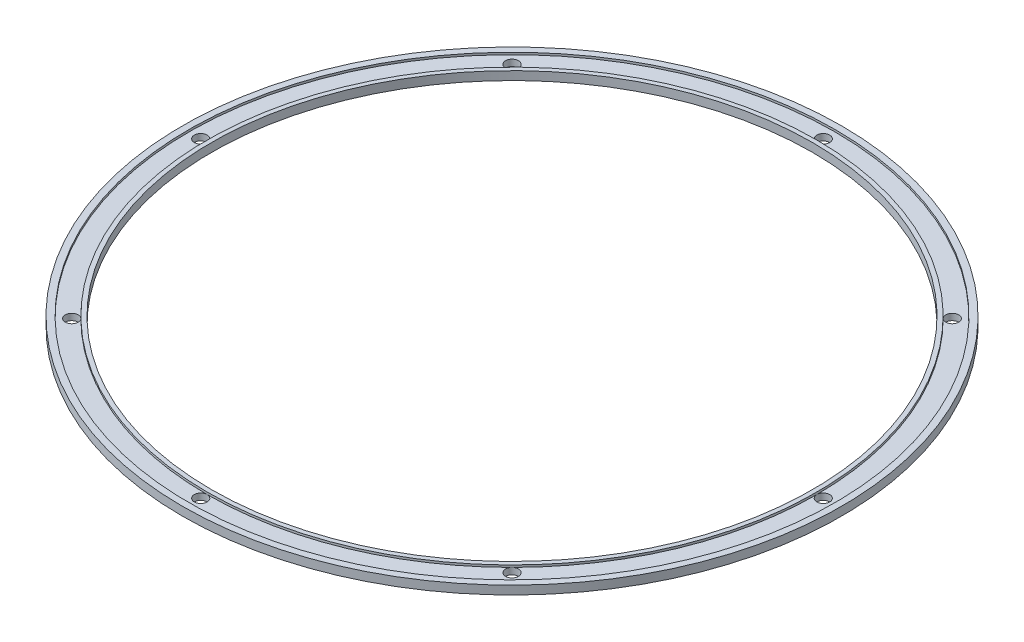
from build123d import *

# Parameters (mm, degrees)
SKETCH_2_R          = 1.5
CUT_EXTRUDE_1_DEPTH = 109.551255175


with BuildPart() as part:
    # 草图1 → 旋转1 (revolve)
    with BuildSketch(Plane.XY, mode=Mode.PRIVATE) as revolve_1_sk:
        Polygon((70, 0), (76.75, 0), (76.75, 2), (75.25, 2), (75.25, 1.5), (71, 1.5), (71, 2), (70, 2), align=None)
    revolve(revolve_1_sk.sketch.rotate(Axis((0, 112.572086065, 0), (0, -1, 0)), 90), axis=Axis((0, 112.572086065, 0), (0, -1, 0)))

    # 草图2 → 切除-拉伸1 (cut, through all)
    with BuildSketch(Plane(origin=(0, 1.5, 0), x_dir=(1, 0, 0), z_dir=(0, 1, 0))):
        with Locations(Location((0, 72.5, 0), (0, 0, 270))):
            Circle(SKETCH_2_R)
        with Locations(Location((51.265241636, 51.265241636, 0), (0, 0, 270))):
            Circle(SKETCH_2_R)
        with Locations(Location((72.5, 0, 0), (0, 0, 270))):
            Circle(SKETCH_2_R)
        with Locations(Location((51.265241636, -51.265241636, 0), (0, 0, 270))):
            Circle(SKETCH_2_R)
        with Locations(Location((0, -72.5, 0), (0, 0, 270))):
            Circle(SKETCH_2_R)
        with Locations(Location((-51.265241636, -51.265241636, 0), (0, 0, 270))):
            Circle(SKETCH_2_R)
        with Locations(Location((-72.5, 0, 0), (0, 0, 270))):
            Circle(SKETCH_2_R)
        with Locations(Location((-51.265241636, 51.265241636, 0), (0, 0, 270))):
            Circle(SKETCH_2_R)
    extrude(amount=-CUT_EXTRUDE_1_DEPTH, mode=Mode.SUBTRACT)


solid = part.part
